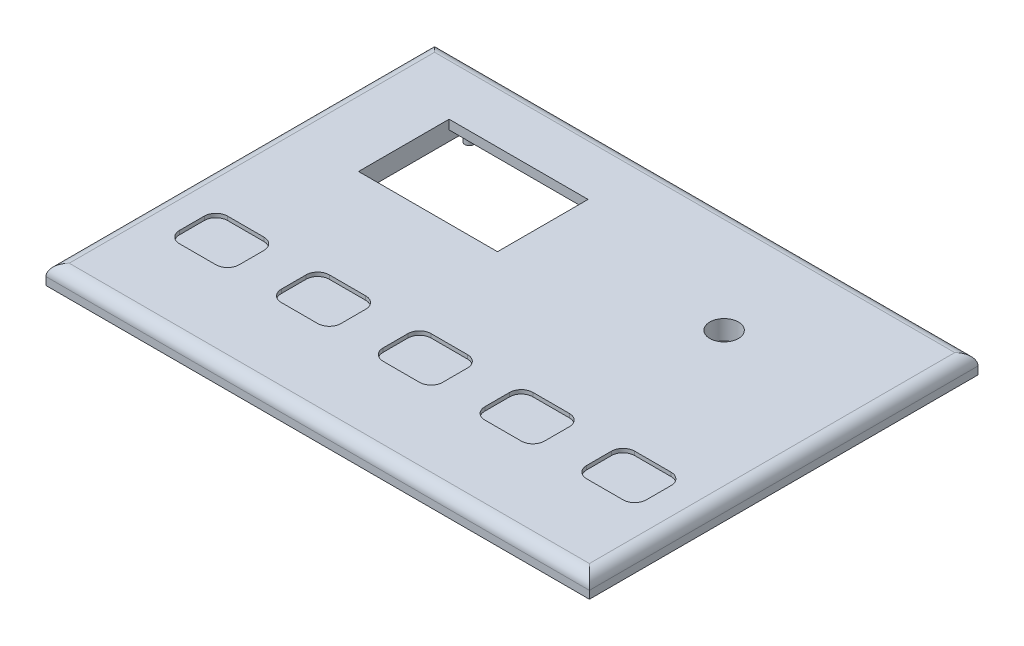
from build123d import *

# Parameters (mm, degrees)
SKETCH1_W           = 140.4
SKETCH1_H           = 100.4
SKETCH1_W_2         = 35.9
SKETCH1_H_2         = 33.9
SKETCH1_R           = 3.7
BOSS_EXTRUDE1_DEPTH = 5
FILLET1_R           = 3
SKETCH3_W           = 35.9
SKETCH3_H           = 5.25
BOSS_EXTRUDE2_DEPTH = 2.4
BOSS_EXTRUDE3_START = -2.6
SKETCH4_R           = 1.2
BOSS_EXTRUDE3_DEPTH = 2.6
SKETCH6_W           = 24.4
SKETCH6_H           = 24.4
CUT_EXTRUDE1_DEPTH  = 3
LPATTERN1_COUNT     = 5
LPATTERN1_PITCH     = 26.3
SKETCH7_R           = 1.1
BOSS_EXTRUDE4_DEPTH = 3
LPATTERN2_COUNT     = 5
LPATTERN2_PITCH     = 26.3
SKETCH9_W           = 15.4
SKETCH9_H           = 12.4
BOSS_EXTRUDE5_DEPTH = 1
LPATTERN3_COUNT     = 5
LPATTERN3_PITCH     = 26.3


with BuildPart() as part:
    # Sketch1 → Boss-Extrude1 (new body)
    with BuildSketch(Plane(origin=(0, 0, 0), x_dir=(1, 0, 0), z_dir=(0, 1, 0))):
        with Locations((0.704074767, -0.111023374)):
            Rectangle(SKETCH1_W, SKETCH1_H)
        with Locations((-31.695925233, 22.288976626)):
            Rectangle(SKETCH1_W_2, SKETCH1_H_2, mode=Mode.SUBTRACT)
        with Locations(Location((33.104074767, 22.288976626, 0), (0, 0, 270))):
            Circle(SKETCH1_R, mode=Mode.SUBTRACT)
        with BuildLine():
            Line((-47.195925233, -28.711023374), (-56.595925233, -28.711023374))
            ThreePointArc((-56.595925233, -28.711023374), (-58.717245577, -27.832343717), (-59.595925233, -25.711023374))
            Line((-59.595925233, -25.711023374), (-59.595925233, -19.311023374))
            ThreePointArc((-59.595925233, -19.311023374), (-58.717245577, -17.18970303), (-56.595925233, -16.311023374))
            Line((-56.595925233, -16.311023374), (-47.195925233, -16.311023374))
            ThreePointArc((-47.195925233, -16.311023374), (-45.07460489, -17.18970303), (-44.195925233, -19.311023374))
            Line((-44.195925233, -19.311023374), (-44.195925233, -25.711023374))
            ThreePointArc((-44.195925233, -25.711023374), (-45.07460489, -27.832343717), (-47.195925233, -28.711023374))
        make_face(mode=Mode.SUBTRACT)
        with BuildLine():
            ThreePointArc((-33.295925233, -19.311023374), (-32.417245577, -17.18970303), (-30.295925233, -16.311023374))
            Line((-30.295925233, -16.311023374), (-20.895925233, -16.311023374))
            ThreePointArc((-20.895925233, -16.311023374), (-18.77460489, -17.18970303), (-17.895925233, -19.311023374))
            Line((-17.895925233, -19.311023374), (-17.895925233, -25.711023374))
            ThreePointArc((-17.895925233, -25.711023374), (-18.77460489, -27.832343717), (-20.895925233, -28.711023374))
            Line((-20.895925233, -28.711023374), (-30.295925233, -28.711023374))
            ThreePointArc((-30.295925233, -28.711023374), (-32.417245577, -27.832343717), (-33.295925233, -25.711023374))
            Line((-33.295925233, -25.711023374), (-33.295925233, -19.311023374))
        make_face(mode=Mode.SUBTRACT)
        with BuildLine():
            ThreePointArc((-6.995925233, -19.311023374), (-6.117245577, -17.18970303), (-3.995925233, -16.311023374))
            Line((-3.995925233, -16.311023374), (5.404074767, -16.311023374))
            ThreePointArc((5.404074767, -16.311023374), (7.52539511, -17.18970303), (8.404074767, -19.311023374))
            Line((8.404074767, -19.311023374), (8.404074767, -25.711023374))
            ThreePointArc((8.404074767, -25.711023374), (7.52539511, -27.832343717), (5.404074767, -28.711023374))
            Line((5.404074767, -28.711023374), (-3.995925233, -28.711023374))
            ThreePointArc((-3.995925233, -28.711023374), (-6.117245577, -27.832343717), (-6.995925233, -25.711023374))
            Line((-6.995925233, -25.711023374), (-6.995925233, -19.311023374))
        make_face(mode=Mode.SUBTRACT)
        with BuildLine():
            ThreePointArc((19.304074767, -19.311023374), (20.182754423, -17.18970303), (22.304074767, -16.311023374))
            Line((22.304074767, -16.311023374), (31.704074767, -16.311023374))
            ThreePointArc((31.704074767, -16.311023374), (33.82539511, -17.18970303), (34.704074767, -19.311023374))
            Line((34.704074767, -19.311023374), (34.704074767, -25.711023374))
            ThreePointArc((34.704074767, -25.711023374), (33.82539511, -27.832343717), (31.704074767, -28.711023374))
            Line((31.704074767, -28.711023374), (22.304074767, -28.711023374))
            ThreePointArc((22.304074767, -28.711023374), (20.182754423, -27.832343717), (19.304074767, -25.711023374))
            Line((19.304074767, -25.711023374), (19.304074767, -19.311023374))
        make_face(mode=Mode.SUBTRACT)
        with BuildLine():
            ThreePointArc((45.604074767, -19.311023374), (46.482754423, -17.18970303), (48.604074767, -16.311023374))
            Line((48.604074767, -16.311023374), (58.004074767, -16.311023374))
            ThreePointArc((58.004074767, -16.311023374), (60.12539511, -17.18970303), (61.004074767, -19.311023374))
            Line((61.004074767, -19.311023374), (61.004074767, -25.711023374))
            ThreePointArc((61.004074767, -25.711023374), (60.12539511, -27.832343717), (58.004074767, -28.711023374))
            Line((58.004074767, -28.711023374), (48.604074767, -28.711023374))
            ThreePointArc((48.604074767, -28.711023374), (46.482754423, -27.832343717), (45.604074767, -25.711023374))
            Line((45.604074767, -25.711023374), (45.604074767, -19.311023374))
        make_face(mode=Mode.SUBTRACT)
    extrude(amount=BOSS_EXTRUDE1_DEPTH)

    # Fillet1
    fillet1_edges = [part.edges().sort_by_distance(p)[0] for p in [
        (0.704074767, 5, 50.311023374),
        (70.904074767, 5, 0.111023374),
        (0.704074767, 5, -50.088976626),
        (-69.495925233, 5, 0.111023374),
    ]]
    fillet(fillet1_edges, radius=FILLET1_R)

    # Sketch3 → Boss-Extrude2 (add)
    with BuildSketch(Plane(origin=(0, 5, 0), x_dir=(1, 0, 0), z_dir=(0, 1, 0))):
        with Locations((-31.695925233, 36.613976626)):
            Rectangle(SKETCH3_W, SKETCH3_H)
        with Locations((-31.695925233, 7.963976626)):
            Rectangle(SKETCH3_W, SKETCH3_H)
    extrude(amount=-BOSS_EXTRUDE2_DEPTH)

    # Sketch4 → Boss-Extrude3 (add)
    with BuildSketch(Plane.XZ.offset(BOSS_EXTRUDE3_START)):
        with Locations(Location((-16.445925233, -36.538976626, 0), (0, 0, 90))):
            Circle(SKETCH4_R)
        with Locations(Location((-46.945925233, -36.538976626, 0), (0, 0, 90))):
            Circle(SKETCH4_R)
        with Locations(Location((-16.445925233, -7.538976626, 0), (0, 0, 90))):
            Circle(SKETCH4_R)
        with Locations(Location((-46.945925233, -7.538976626, 0), (0, 0, 90))):
            Circle(SKETCH4_R)
    extrude(amount=BOSS_EXTRUDE3_DEPTH)

    # Sketch6 → Cut-Extrude1 (cut)
    with BuildSketch(Plane.XZ):
        with Locations((-51.895925233, 28.211023374)):
            Rectangle(SKETCH6_W, SKETCH6_H)
    cut_extrude1 = extrude(amount=-CUT_EXTRUDE1_DEPTH, mode=Mode.SUBTRACT)

    # LPattern1: Cut-Extrude1 ×5
    with Locations(*[(i * LPATTERN1_PITCH, 0, 0) for i in range(1, LPATTERN1_COUNT)]):
        add(cut_extrude1, mode=Mode.SUBTRACT)

    # Sketch7 → Boss-Extrude4 (add)
    with BuildSketch(Plane.XZ.offset(-3)):
        with Locations(Location((-61.495925233, 37.811023374, 0), (0, 0, 90))):
            Circle(SKETCH7_R)
        with Locations(Location((-42.295925233, 37.811023374, 0), (0, 0, 90))):
            Circle(SKETCH7_R)
        with Locations(Location((-61.495925233, 18.611023374, 0), (0, 0, 90))):
            Circle(SKETCH7_R)
        with Locations(Location((-42.295925233, 18.611023374, 0), (0, 0, 90))):
            Circle(SKETCH7_R)
    boss_extrude4 = extrude(amount=BOSS_EXTRUDE4_DEPTH)

    # LPattern2: Boss-Extrude4 ×5
    with Locations(*[(i * LPATTERN2_PITCH, 0, 0) for i in range(1, LPATTERN2_COUNT)]):
        add(boss_extrude4)

    # Sketch9 → Boss-Extrude5 (add)
    with BuildSketch(Plane.XZ.offset(-3)):
        with Locations((-51.895925233, 22.511023374)):
            Rectangle(SKETCH9_W, SKETCH9_H)
    boss_extrude5 = extrude(amount=-BOSS_EXTRUDE5_DEPTH)

    # LPattern3: Boss-Extrude5 ×5
    with Locations(*[(i * LPATTERN3_PITCH, 0, 0) for i in range(1, LPATTERN3_COUNT)]):
        add(boss_extrude5)


solid = part.part
